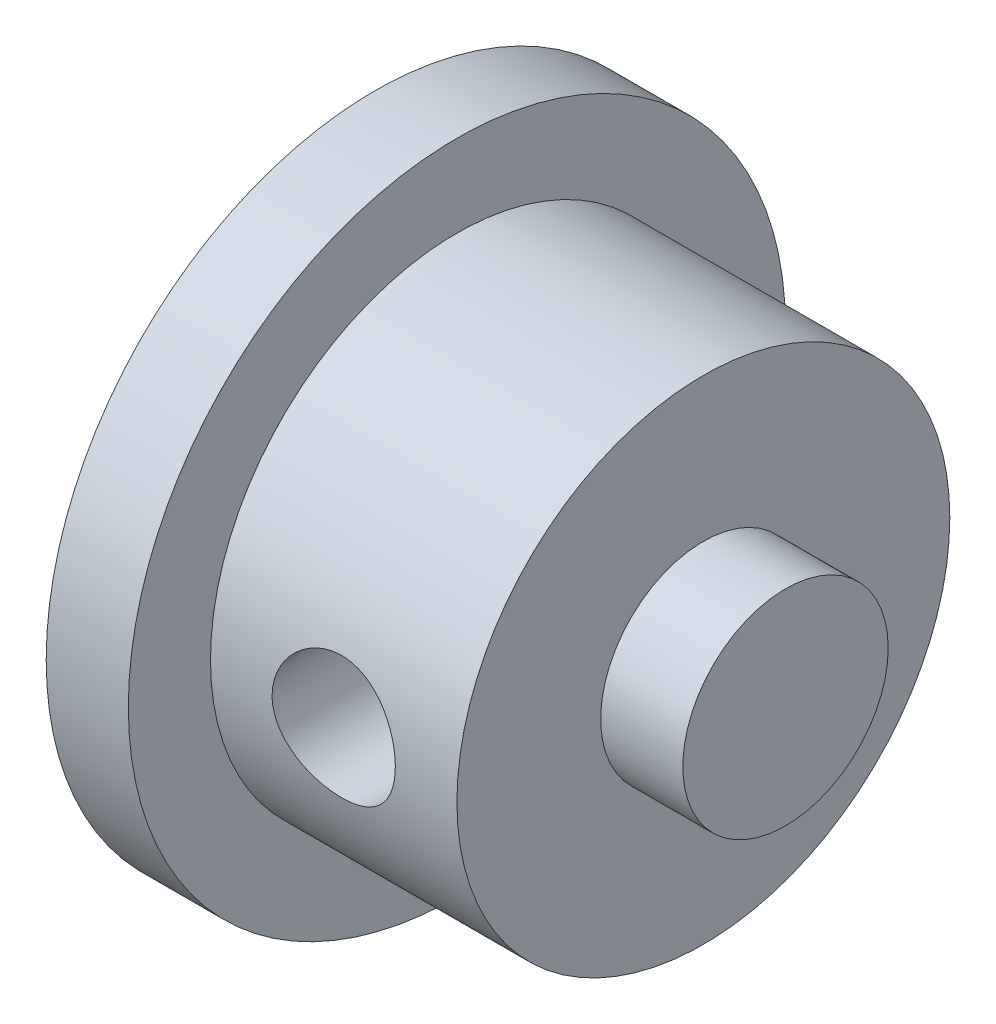
from build123d import *

# Parameters (mm, degrees)
CUT_EXTRUDE2_DEPTH      = 90.451272324
CUT_EXTRUDE2_DEPTH_BACK = 90.451272324
SKETCH5_R               = 1.5
CUT_EXTRUDE3_START      = -2
SKETCH7_R               = 8
CUT_EXTRUDE3_DEPTH      = 2
BOSS_EXTRUDE1_START     = -2
SKETCH2_R               = 2.5
BOSS_EXTRUDE1_DEPTH     = 2


with BuildPart() as part:
    # Sketch1 → Revolve2 (revolve)
    with BuildSketch(Plane.XY, mode=Mode.PRIVATE) as revolve2_sk:
        Polygon((-85.136081821, -10.256002982), (-85.136081821, -18.256002982), (-75.136081821, -18.256002982), (-75.136081821, -10.256002982), (-77.136081821, -10.256002982), (-77.136081821, -12.256002982), (-83.136081821, -12.256002982), (-83.136081821, -10.256002982), align=None)
    revolve(revolve2_sk.sketch.rotate(Axis((-85.136081821, -18.256002982, 0), (1, 0, 0)), 90), axis=Axis((-85.136081821, -18.256002982, 0), (1, 0, 0)))

    # Sketch5 → Cut-Extrude2 (cut, two sides: drawn at the far end of the back side and taken through both)
    with BuildSketch(Plane.XY.offset(-CUT_EXTRUDE2_DEPTH_BACK)):
        with Locations((-80.136081821, -18.256002982)):
            Circle(SKETCH5_R)
    extrude(amount=CUT_EXTRUDE2_DEPTH + CUT_EXTRUDE2_DEPTH_BACK, mode=Mode.SUBTRACT)

    # Sketch7 → Cut-Extrude3 (cut)
    with BuildSketch(Plane(origin=(-75.136081821, 0, 0), x_dir=(0, 0, -1), z_dir=(1, 0, 0)).offset(CUT_EXTRUDE3_START)):
        with Locations(Location((0, -18.256002982, 0), (0, 0, 180))):
            Circle(SKETCH7_R)
    extrude(amount=CUT_EXTRUDE3_DEPTH, mode=Mode.SUBTRACT)

    # Sketch2 → Boss-Extrude1 (add)
    with BuildSketch(Plane(origin=(-75.136081821, 0, 0), x_dir=(0, 0, -1), z_dir=(1, 0, 0)).offset(BOSS_EXTRUDE1_START)):
        with Locations((0, -18.256002982)):
            Circle(SKETCH2_R)
    extrude(amount=BOSS_EXTRUDE1_DEPTH)


solid = part.part
